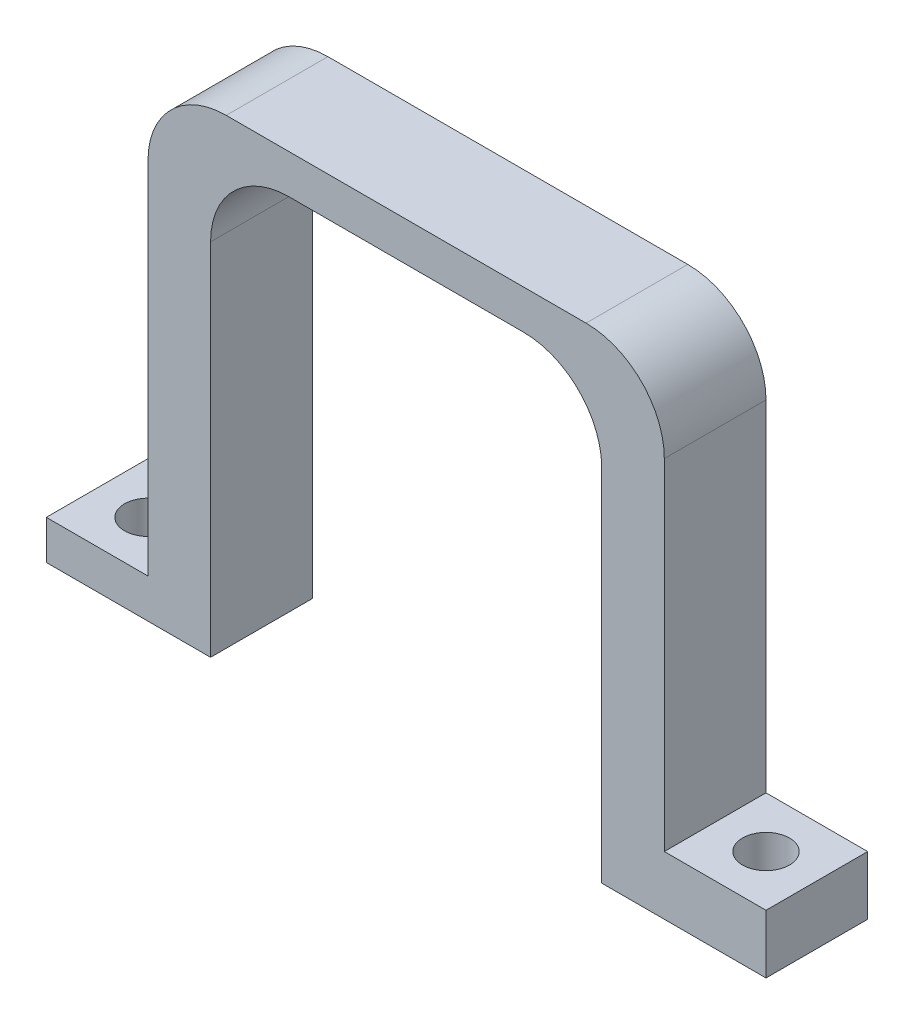
from build123d import *

# Parameters (mm, degrees)
EXTRUDE_1_DEPTH     = 2.6
FILLET_1_R          = 2
SKETCH_2_W          = 2.6
SKETCH_2_H          = 2.6
SKETCH_2_R          = 0.6
EXTRUDE_2_DEPTH     = 1.5
SKETCH_3_W          = 2.6
SKETCH_3_H          = 0.5
CUT_EXTRUDE_1_DEPTH = 12.340634903


with BuildPart() as part:
    # 草图1 → 凸台-拉伸1 (new body)
    with BuildSketch(Plane.XY):
        Polygon((6.6, 6.1), (-6.6, 6.1), (-6.6, -6.1), (-5, -6.1), (-5, 5.1), (5, 5.1), (5, -6.1), (6.6, -6.1), align=None)
    extrude(amount=EXTRUDE_1_DEPTH)

    # 圆角1
    fillet_1_edges = [part.edges().sort_by_distance(p)[0] for p in [
        (5, 5.1, 1.3),
        (-5, 5.1, 1.3),
        (-6.6, 6.1, 1.3),
        (6.6, 6.1, 1.3),
    ]]
    fillet(fillet_1_edges, radius=FILLET_1_R)

    # 草图2 → 凸台-拉伸2 (add)
    # profile 1 of 2: a face of its own
    with BuildSketch(Plane.XZ.offset(6.1)):
        with Locations((-7.9, 1.3)):
            Rectangle(SKETCH_2_W, SKETCH_2_H)
        with Locations(Location((-7.9, 1.3, 0), (0, 0, 270))):
            Circle(SKETCH_2_R, mode=Mode.SUBTRACT)
    # profile 2 of 2: a face of its own
    with BuildSketch(Plane.XZ.offset(6.1)):
        with Locations((7.9, 1.3)):
            Rectangle(SKETCH_2_W, SKETCH_2_H)
        with Locations(Location((7.9, 1.3, 0), (0, 0, 270))):
            Circle(SKETCH_2_R, mode=Mode.SUBTRACT)
    extrude(amount=-EXTRUDE_2_DEPTH)

    # 草图3 → 切除-拉伸1 (cut, through all)
    with BuildSketch(Plane(origin=(0, 0, 0), x_dir=(-1, 0, 0), z_dir=(0, 0, -1))):
        with Locations((7.9, -4.85)):
            Rectangle(SKETCH_3_W, SKETCH_3_H)
    extrude(amount=-CUT_EXTRUDE_1_DEPTH, mode=Mode.SUBTRACT)


solid = part.part
